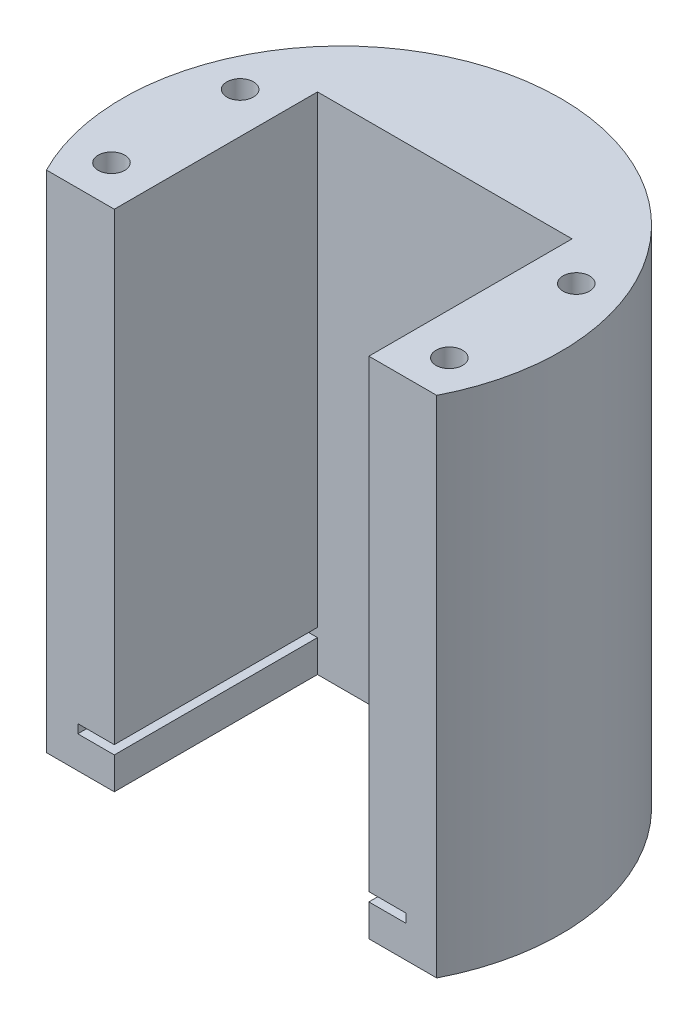
from build123d import *

# Parameters (mm, degrees)
SKETCH1_R           = 3
BOSS_EXTRUDE2_DEPTH = 114
CUT_EXTRUDE1_REACH  = 145.698
SKETCH2_W           = 74.122822233
SKETCH2_H           = 2


with BuildPart() as part:
    # Sketch1 → Boss-Extrude2 (new body)
    with BuildSketch(Plane(origin=(0, 0, 0), x_dir=(1, 0, 0), z_dir=(0, 1, 0))):
        with BuildLine():
            Line((-44.083041608, -22.581105876), (-28.757656934, -22.581105876))
            Line((-28.757656934, -22.581105876), (-28.757656934, 23.321119009))
            Line((-28.757656934, 23.321119009), (28.757656934, 23.321119009))
            Line((28.757656934, 23.321119009), (28.757656934, -22.581105876))
            Line((28.757656934, -22.581105876), (44.083041608, -22.581105876))
            ThreePointArc((44.083041608, -22.581105876), (48.149008042, -11.614384382), (49.53, 0))
            ThreePointArc((49.53, 0), (-11.614384382, 48.149008042), (-44.083041608, -22.581105876))
        make_face()
        with Locations(Location((-38.161341973, -13.812642955, 0), (0, 0, 270))):
            Circle(SKETCH1_R, mode=Mode.SUBTRACT)
        with Locations(Location((38.161341973, -13.812642955, 0), (0, 0, 270))):
            Circle(SKETCH1_R, mode=Mode.SUBTRACT)
        with Locations(Location((-37.971229362, 15.060391099, 0), (0, 0, 270))):
            Circle(SKETCH1_R, mode=Mode.SUBTRACT)
        with Locations(Location((37.971229362, 15.060391099, 0), (0, 0, 270))):
            Circle(SKETCH1_R, mode=Mode.SUBTRACT)
    extrude(amount=BOSS_EXTRUDE2_DEPTH)

    # Cut-Extrude1: up to this face of the body (flat: up to its plane)
    cut_extrude1_end = Plane(part.part.faces().sort_by_distance((0, 57, -23.321119009))[0])
    # Sketch2 → Cut-Extrude1 (cut, up to the picked face)
    with BuildSketch(Plane.XY.offset(22.581105876), mode=Mode.PRIVATE) as cut_extrude1_sk1:
        with Locations((0.055039457, 8.229827968)):
            Rectangle(SKETCH2_W, SKETCH2_H)
    cut_extrude1_tool1 = split(extrude(cut_extrude1_sk1.sketch, amount=-CUT_EXTRUDE1_REACH, mode=Mode.PRIVATE), bisect_by=cut_extrude1_end, keep=Keep.BOTH, mode=Mode.PRIVATE)
    add(cut_extrude1_tool1.solids().sort_by(Axis((0.055039, 8.229828, 22.581106), (0, 0, -1)))[0], mode=Mode.SUBTRACT)


solid = part.part
